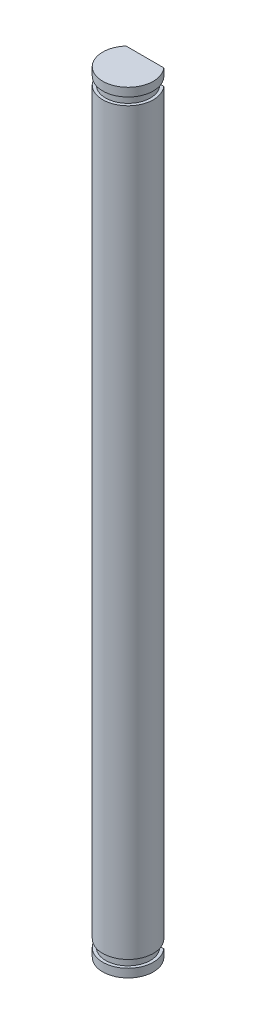
from build123d import *

# Parameters (mm, degrees)
BOSS_EXTRUDE1_DEPTH = 45.72
SKETCH2_W           = 0.35
SKETCH2_H           = 0.9


with BuildPart() as part:
    # Sketch1 → Boss-Extrude1 (new, symmetric)
    with BuildSketch(Plane(origin=(0, 0, 0), x_dir=(1, 0, 0), z_dir=(0, 1, 0))):
        with BuildLine():
            Line((-2.236067977, 2), (2.236067977, 2))
            ThreePointArc((2.236067977, 2), (0, -3), (-2.236067977, 2))
        make_face()
    extrude(amount=BOSS_EXTRUDE1_DEPTH, both=True)

    # Sketch2 → Cut-Revolve1 (revolve, cut)
    with BuildSketch(Plane.XY):
        with Locations((2.825, 44.27)):
            Rectangle(SKETCH2_W, SKETCH2_H)
        with Locations((2.825, -44.27)):
            Rectangle(SKETCH2_W, SKETCH2_H)
    revolve(axis=Axis((0, 48.05613995, 0), (0, -1, 0)), mode=Mode.SUBTRACT)


solid = part.part
